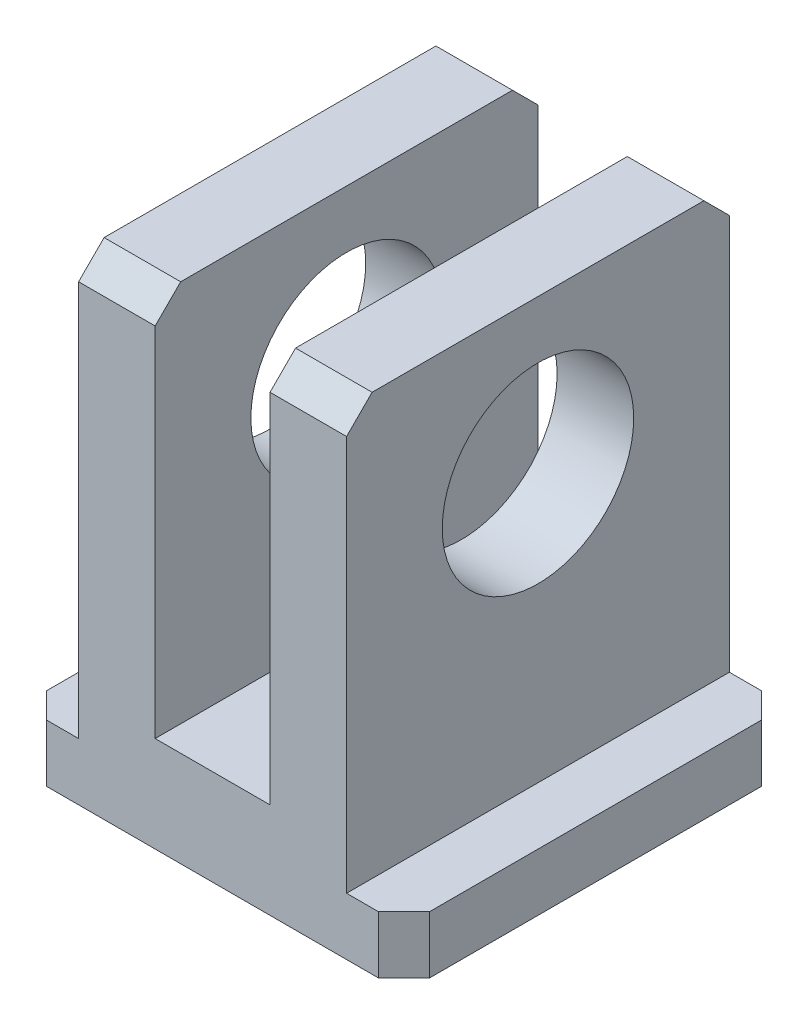
from build123d import *

# Parameters (mm, degrees)
EXTRUDE_1_DEPTH          = 4.5
SKETCH_2_W               = 21
SKETCH_2_H               = 30
EXTRUDE_2_DEPTH          = 3
SKETCH_3_W               = 6
SKETCH_3_H               = 30
EXTRUDE_3_DEPTH          = 30
CUT_EXTRUDE_1_DEPTH      = 30
CUT_EXTRUDE_1_DEPTH_BACK = 30
SKETCH_4_R               = 7.5


with BuildPart() as part:
    # 草图1 → 凸台-拉伸1 (new body)
    with BuildSketch(Plane(origin=(0, 0, 0), x_dir=(1, 0, 0), z_dir=(0, 1, 0))):
        Polygon((13, 15), (15, 13), (15, -13), (13, -15), (-13, -15), (-15, -13), (-15, 13), (-13, 15), align=None)
    extrude(amount=EXTRUDE_1_DEPTH)

    # 草图2 → 凸台-拉伸2 (add)
    with BuildSketch(Plane(origin=(0, 4.5, 0), x_dir=(1, 0, 0), z_dir=(0, 1, 0))):
        Rectangle(SKETCH_2_W, SKETCH_2_H)
    extrude(amount=EXTRUDE_2_DEPTH)

    # 草图3 → 凸台-拉伸3 (add)
    with BuildSketch(Plane(origin=(0, 7.5, 0), x_dir=(1, 0, 0), z_dir=(0, 1, 0))):
        with Locations((-7.5, 0)):
            Rectangle(SKETCH_3_W, SKETCH_3_H)
        with Locations((7.5, 0)):
            Rectangle(SKETCH_3_W, SKETCH_3_H)
    extrude(amount=EXTRUDE_3_DEPTH)

    # 草图4 → 切除-拉伸1 (cut, two sides: drawn at the far end of the back side and taken through both)
    with BuildSketch(Plane(origin=(10.5, 0, 0), x_dir=(0, 0, -1), z_dir=(1, 0, 0)).offset(-CUT_EXTRUDE_1_DEPTH_BACK)):
        with Locations(Location((0, 25.5, 0), (0, 0, 180))):
            Circle(SKETCH_4_R)
        Polygon((-13, 37.5), (-15, 35.5), (-15, 37.5), align=None)
        Polygon((15, 37.5), (13, 37.5), (15, 35.5), align=None)
    extrude(amount=CUT_EXTRUDE_1_DEPTH + CUT_EXTRUDE_1_DEPTH_BACK, mode=Mode.SUBTRACT)


solid = part.part
